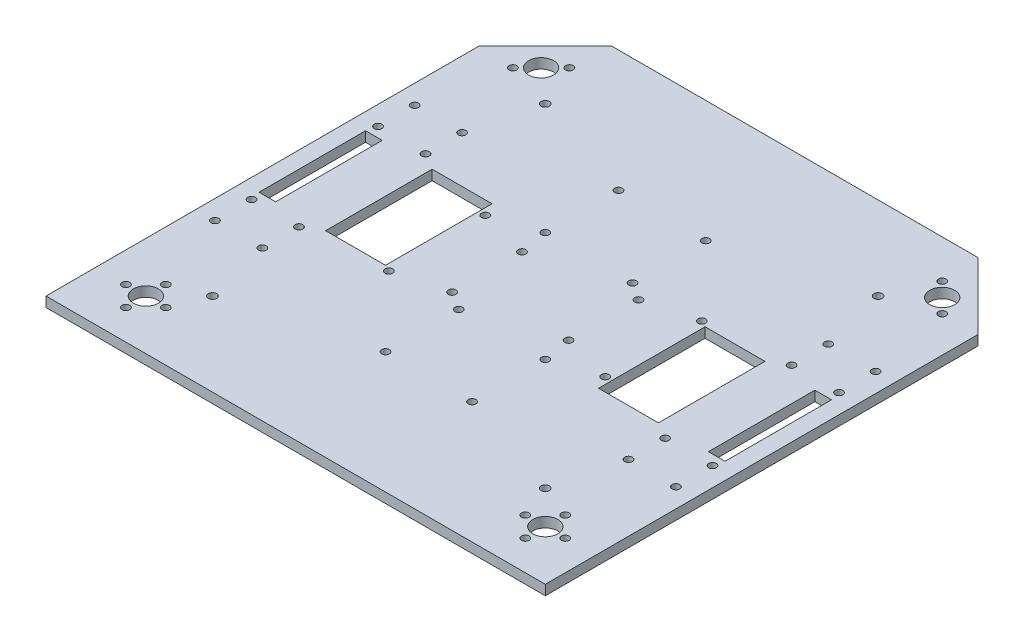
from build123d import *

# Parameters (mm, degrees)
ESQUISSE1_R              = 7.5
ESQUISSE1_R_2            = 2.3
BOSS_EXTRU_1_DEPTH       = 6
ENL_V_MAT_EXTRU_9_DEPTH  = 10.5
ESQUISSE6_R              = 2.3
ENL_V_MAT_EXTRU_10_DEPTH = 50
ENL_V_MAT_EXTRU_11_DEPTH = 50
ESQUISSE9_R              = 2.5
ENL_V_MAT_EXTRU_12_DEPTH = 35
ESQUISSE3_R              = 2.3
ENL_V_MAT_EXTRU_13_DEPTH = 35
ESQUISSE10_R             = 2.3
ENL_V_MAT_EXTRU_14_DEPTH = 10


with BuildPart() as part:
    # Esquisse1 → Boss.-Extru.1 (new body)
    with BuildSketch(Plane(origin=(0, 0, 0), x_dir=(1, 0, 0), z_dir=(0, 1, 0))):
        Polygon((-150, 0), (-150, 260), (-110, 300), (110, 300), (150, 260), (150, 0), align=None)
        with Locations(Location((-120, 30, 0), (0, 0, 270))):
            Circle(ESQUISSE1_R, mode=Mode.SUBTRACT)
        with Locations(Location((-120, 267.5, 0), (0, 0, 270))):
            Circle(ESQUISSE1_R, mode=Mode.SUBTRACT)
        with Locations(Location((120, 268.5, 0), (0, 0, 270))):
            Circle(ESQUISSE1_R, mode=Mode.SUBTRACT)
        with Locations(Location((-111.514718626, 275.985281374, 0), (0, 0, 270))):
            Circle(ESQUISSE1_R_2, mode=Mode.SUBTRACT)
        with Locations(Location((-128.485281374, 259.014718626, 0), (0, 0, 270))):
            Circle(ESQUISSE1_R_2, mode=Mode.SUBTRACT)
        with Locations(Location((111.514718626, 276.985281374, 0), (0, 0, 270))):
            Circle(ESQUISSE1_R_2, mode=Mode.SUBTRACT)
        with Locations(Location((128.485281374, 260.014718626, 0), (0, 0, 270))):
            Circle(ESQUISSE1_R_2, mode=Mode.SUBTRACT)
        with Locations(Location((120, 30, 0), (0, 0, 270))):
            Circle(ESQUISSE1_R, mode=Mode.SUBTRACT)
        with Locations(Location((120, 42, 0), (0, 0, 270))):
            Circle(ESQUISSE1_R_2, mode=Mode.SUBTRACT)
        with Locations(Location((-120, 42, 0), (0, 0, 270))):
            Circle(ESQUISSE1_R_2, mode=Mode.SUBTRACT)
        with Locations(Location((-120, 18, 0), (0, 0, 270))):
            Circle(ESQUISSE1_R_2, mode=Mode.SUBTRACT)
        with Locations(Location((-132, 30, 0), (0, 0, 270))):
            Circle(ESQUISSE1_R_2, mode=Mode.SUBTRACT)
        with Locations(Location((-108, 30, 0), (0, 0, 270))):
            Circle(ESQUISSE1_R_2, mode=Mode.SUBTRACT)
        with Locations(Location((108, 30, 0), (0, 0, 270))):
            Circle(ESQUISSE1_R_2, mode=Mode.SUBTRACT)
        with Locations(Location((132, 30, 0), (0, 0, 270))):
            Circle(ESQUISSE1_R_2, mode=Mode.SUBTRACT)
        with Locations(Location((120, 18, 0), (0, 0, 270))):
            Circle(ESQUISSE1_R_2, mode=Mode.SUBTRACT)
    extrude(amount=BOSS_EXTRU_1_DEPTH)

    # Esquisse7 → Enlèv. mat.-Extru.9 (cut)
    with BuildSketch(Plane(origin=(0, 6, 0), x_dir=(1, 0, 0), z_dir=(0, 1, 0))):
        Polygon((-130, 150), (-130, 182), (-140, 182), (-140, 118), (-130, 118), align=None)
    enl_v_mat_extru_9 = extrude(amount=-ENL_V_MAT_EXTRU_9_DEPTH, mode=Mode.SUBTRACT)

    # Esquisse6 → Enlèv. mat.-Extru.10 (cut)
    with BuildSketch(Plane(origin=(0, 6, 0), x_dir=(1, 0, 0), z_dir=(0, 1, 0))):
        with Locations(Location((110, 210, 0), (0, 0, 270))):
            Circle(ESQUISSE6_R)
        with Locations(Location((138.5, 210, 0), (0, 0, 270))):
            Circle(ESQUISSE6_R)
        with Locations(Location((138.5, 188, 0), (0, 0, 270))):
            Circle(ESQUISSE6_R)
        with Locations(Location((110, 188, 0), (0, 0, 270))):
            Circle(ESQUISSE6_R)
        with Locations(Location((-138.5, 90, 0), (0, 0, 270))):
            Circle(ESQUISSE6_R)
        with Locations(Location((-138.5, 112, 0), (0, 0, 270))):
            Circle(ESQUISSE6_R)
        with Locations(Location((-110, 112, 0), (0, 0, 270))):
            Circle(ESQUISSE6_R)
        with Locations(Location((-110, 90, 0), (0, 0, 270))):
            Circle(ESQUISSE6_R)
    enl_v_mat_extru_10 = extrude(amount=-ENL_V_MAT_EXTRU_10_DEPTH, mode=Mode.SUBTRACT)

    # Esquisse4 → Enlèv. mat.-Extru.11 (cut)
    with BuildSketch(Plane(origin=(0, 6, 0), x_dir=(1, 0, 0), z_dir=(0, 1, 0))):
        Polygon((-100, 150), (-100, 182), (-64, 182), (-64, 118), (-100, 118), align=None)
    enl_v_mat_extru_11 = extrude(amount=-ENL_V_MAT_EXTRU_11_DEPTH, mode=Mode.SUBTRACT)

    # Symétrie1: Enlèv. mat.-Extru.9 across plane
    add(enl_v_mat_extru_9.mirror(Plane(origin=(0, 0, 0), x_dir=(0, 0, 1), z_dir=(1, 0, 0))), mode=Mode.SUBTRACT)

    # Symétrie2: Enlèv. mat.-Extru.11 across plane
    add(enl_v_mat_extru_11.mirror(Plane(origin=(0, 0, 0), x_dir=(0, 0, 1), z_dir=(1, 0, 0))), mode=Mode.SUBTRACT)

    # Symétrie3: Enlèv. mat.-Extru.10 across plane
    add(enl_v_mat_extru_10.mirror(Plane(origin=(0, 0, 0), x_dir=(0, 0, 1), z_dir=(1, 0, 0))), mode=Mode.SUBTRACT)

    # Esquisse9 → Enlèv. mat.-Extru.12 (cut)
    with BuildSketch(Plane(origin=(0, 6, 0), x_dir=(1, 0, 0), z_dir=(0, 1, 0))):
        with Locations(Location((-100, 50, 0), (0, 0, 270))):
            Circle(ESQUISSE9_R)
        with Locations(Location((100, 50, 0), (0, 0, 270))):
            Circle(ESQUISSE9_R)
        with Locations(Location((100, 250, 0), (0, 0, 270))):
            Circle(ESQUISSE9_R)
        with Locations(Location((-100, 250, 0), (0, 0, 270))):
            Circle(ESQUISSE9_R)
    extrude(amount=-ENL_V_MAT_EXTRU_12_DEPTH, mode=Mode.SUBTRACT)

    # Esquisse3 → Enlèv. mat.-Extru.13 (cut)
    with BuildSketch(Plane(origin=(0, 6, 0), x_dir=(1, 0, 0), z_dir=(0, 1, 0))):
        with Locations(Location((-60, 174, 0), (0, 0, 270))):
            Circle(ESQUISSE3_R)
        with Locations(Location((-60, 116, 0), (0, 0, 270))):
            Circle(ESQUISSE3_R)
        with Locations(Location((-30, 166, 0), (0, 0, 270))):
            Circle(ESQUISSE3_R)
        with Locations(Location((-30, 124, 0), (0, 0, 270))):
            Circle(ESQUISSE3_R)
        with Locations(Location((60, 184, 0), (0, 0, 270))):
            Circle(ESQUISSE3_R)
        with Locations(Location((30, 176, 0), (0, 0, 270))):
            Circle(ESQUISSE3_R)
        with Locations(Location((30, 134, 0), (0, 0, 270))):
            Circle(ESQUISSE3_R)
        with Locations(Location((60, 126, 0), (0, 0, 270))):
            Circle(ESQUISSE3_R)
    extrude(amount=-ENL_V_MAT_EXTRU_13_DEPTH, mode=Mode.SUBTRACT)

    # Esquisse10 → Enlèv. mat.-Extru.14 (cut)
    with BuildSketch(Plane(origin=(0, 6, 0), x_dir=(1, 0, 0), z_dir=(0, 1, 0))):
        with Locations(Location((-33, 227, 0), (0, 0, 270))):
            Circle(ESQUISSE10_R)
        with Locations(Location((-19, 73, 0), (0, 0, 270))):
            Circle(ESQUISSE10_R)
        with Locations(Location((33, 73, 0), (0, 0, 270))):
            Circle(ESQUISSE10_R)
        with Locations(Location((-33, 183, 0), (0, 0, 270))):
            Circle(ESQUISSE10_R)
        with Locations(Location((33, 117, 0), (0, 0, 270))):
            Circle(ESQUISSE10_R)
        with Locations(Location((-19, 117, 0), (0, 0, 270))):
            Circle(ESQUISSE10_R)
        with Locations(Location((19.4, 227, 0), (0, 0, 270))):
            Circle(ESQUISSE10_R)
        with Locations(Location((19.4, 183, 0), (0, 0, 270))):
            Circle(ESQUISSE10_R)
    extrude(amount=-ENL_V_MAT_EXTRU_14_DEPTH, mode=Mode.SUBTRACT)


solid = part.part
